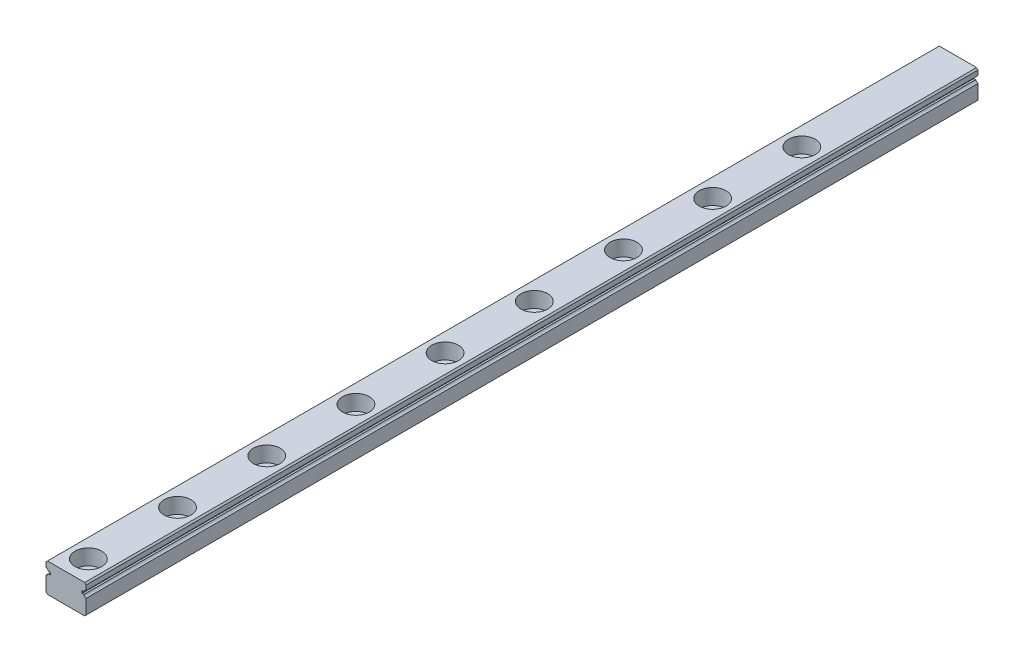
from build123d import *

# Parameters (mm, degrees)
EXTRUDE_1_DEPTH              = 200
HOLE_WIZARD_M2_1_D           = 2.4
HOLE_WIZARD_M2_1_CBORE_D     = 6
HOLE_WIZARD_M2_1_CBORE_DEPTH = 3.5
PATTERN_LINEAR_1_COUNT       = 9
PATTERN_LINEAR_1_PITCH       = 20


with BuildPart() as part:
    # 草图1 → 凸台-拉伸1 (new body)
    with BuildSketch(Plane.XY):
        with BuildLine():
            Line((-4.5, -2.905269119), (-4.5, -6.175269119))
            Line((-4.5, -6.175269119), (-4.174730881, -6.500538239))
            Line((-4.174730881, -6.500538239), (0, -6.500538239))
            Line((0, -6.500538239), (4.174730881, -6.500538239))
            Line((4.174730881, -6.500538239), (4.5, -6.175269119))
            Line((4.5, -6.175269119), (4.5, -2.905269119))
            ThreePointArc((4.5, -2.905269119), (4.188070601, -2.722678698), (3.990111871, -2.420269119))
            Line((3.990111871, -2.420269119), (3.630111871, -2.420269119))
            ThreePointArc((3.630111871, -2.420269119), (3.566472261, -2.39390873), (3.540111871, -2.330269119))
            Line((3.540111871, -2.330269119), (3.540111871, -1.970269119))
            ThreePointArc((3.540111871, -1.970269119), (3.566472261, -1.906629509), (3.630111871, -1.880269119))
            Line((3.630111871, -1.880269119), (3.990111871, -1.880269119))
            ThreePointArc((3.990111871, -1.880269119), (4.188070601, -1.577859541), (4.5, -1.395269119))
            Line((4.5, -1.395269119), (4.5, -0.325269119))
            Line((4.5, -0.325269119), (4.174730881, 0))
            Line((4.174730881, 0), (0, 0))
            Line((0, 0), (-4.174730881, 0))
            Line((-4.174730881, 0), (-4.5, -0.325269119))
            Line((-4.5, -0.325269119), (-4.5, -1.395269119))
            ThreePointArc((-4.5, -1.395269119), (-4.188070601, -1.577859541), (-3.990111871, -1.880269119))
            Line((-3.990111871, -1.880269119), (-3.630111871, -1.880269119))
            ThreePointArc((-3.630111871, -1.880269119), (-3.566472261, -1.906629509), (-3.540111871, -1.970269119))
            Line((-3.540111871, -1.970269119), (-3.540111871, -2.330269119))
            ThreePointArc((-3.540111871, -2.330269119), (-3.566472261, -2.39390873), (-3.630111871, -2.420269119))
            Line((-3.630111871, -2.420269119), (-3.990111871, -2.420269119))
            ThreePointArc((-3.990111871, -2.420269119), (-4.188070601, -2.722678698), (-4.5, -2.905269119))
        make_face()
    extrude(amount=EXTRUDE_1_DEPTH)

    # M2 六角头螺栓的柱形沉头孔1 (through all)
    with Locations(Plane(origin=(0, 0, 0), x_dir=(1, 0, 0), z_dir=(0, 1, 0))):
        with Locations((0, -195)):
            hole_wizard_m2_1 = CounterBoreHole(HOLE_WIZARD_M2_1_D / 2, HOLE_WIZARD_M2_1_CBORE_D / 2, HOLE_WIZARD_M2_1_CBORE_DEPTH)

    # 阵列(线性)1: M2 六角头螺栓的柱形沉头孔1 ×9
    with Locations(*[(0, 0, -i * PATTERN_LINEAR_1_PITCH) for i in range(1, PATTERN_LINEAR_1_COUNT)]):
        add(hole_wizard_m2_1, mode=Mode.SUBTRACT)


solid = part.part
